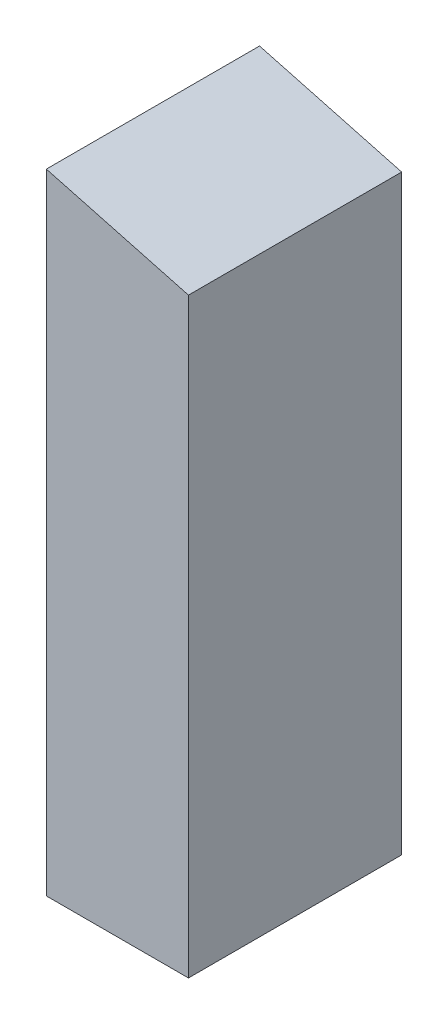
from build123d import *

# Parameters (mm, degrees)
SALIENTE_EXTRUIR1_DEPTH = 76.2


with BuildPart() as part:
    # Croquis1 → Saliente-Extruir1 (new body)
    with BuildSketch(Plane.XY):
        Polygon((0, 0), (0, 225), (50.8, 211.388181024), (50.8, 0), align=None)
    extrude(amount=SALIENTE_EXTRUIR1_DEPTH)


solid = part.part
